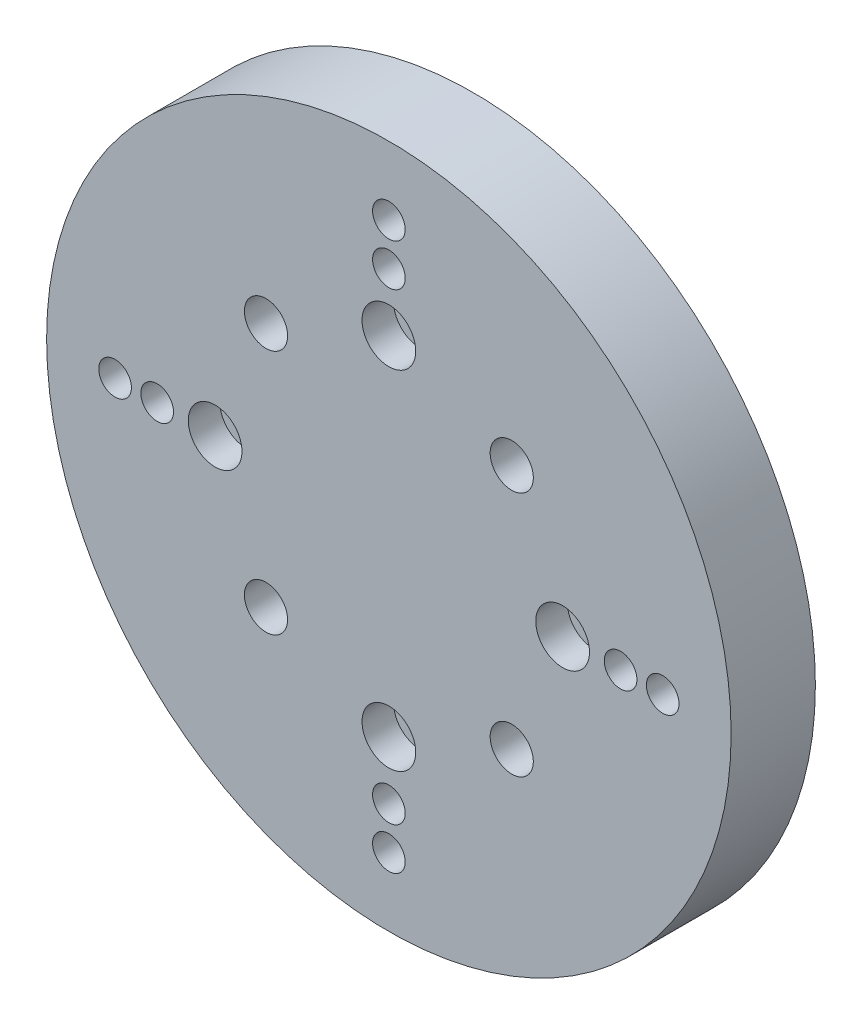
from build123d import *

# Parameters (mm, degrees)
SKETCH1_R           = 55
BOSS_EXTRUDE1_DEPTH = 26
SKETCH2_R           = 1.5
CUT_EXTRUDE1_DEPTH  = 3
SKETCH3_R           = 32.5
BOSS_EXTRUDE2_DEPTH = 8
SKETCH4_R           = 2.55
SKETCH4_R_2         = 1.55
SKETCH4_R_3         = 2.05
CUT_EXTRUDE2_DEPTH  = 3
FILLET1_R           = 2
SKETCH9_R           = 75
CUT_EXTRUDE5_DEPTH  = 83.012194282
SKETCH11_R          = 10
CUT_EXTRUDE6_DEPTH  = 5


with BuildPart() as part:
    # Sketch1 → Boss-Extrude1 (new body)
    with BuildSketch(Plane.XY):
        with Locations(Location((0, 0, 0), (0, 0, 180))):
            Circle(SKETCH1_R)
    extrude(amount=BOSS_EXTRUDE1_DEPTH)

    # Sketch2 → Cut-Extrude1 (cut)
    with BuildSketch(Plane(origin=(0, 0, 0), x_dir=(-1, 0, 0), z_dir=(0, 0, -1))):
        with Locations((0, -21)):
            Circle(SKETCH2_R)
        with Locations((-14.849242405, -14.849242405)):
            Circle(SKETCH2_R)
        with Locations((-21, 0)):
            Circle(SKETCH2_R)
        with Locations((-14.849242405, 14.849242405)):
            Circle(SKETCH2_R)
        with Locations((0, 21)):
            Circle(SKETCH2_R)
        with Locations((14.849242405, 14.849242405)):
            Circle(SKETCH2_R)
        with Locations((21, 0)):
            Circle(SKETCH2_R)
        with Locations((14.849242405, -14.849242405)):
            Circle(SKETCH2_R)
    extrude(amount=-CUT_EXTRUDE1_DEPTH, mode=Mode.SUBTRACT)

    # Sketch3 → Boss-Extrude2 (add)
    with BuildSketch(Plane.XY.offset(26)):
        Circle(SKETCH3_R)
    extrude(amount=BOSS_EXTRUDE2_DEPTH)

    # Sketch4 → Cut-Extrude2 (cut)
    with BuildSketch(Plane.XY.offset(34)):
        with Locations((-16.5, 0)):
            Circle(SKETCH4_R)
        with Locations((0, -16.5)):
            Circle(SKETCH4_R)
        with Locations((16.5, 0)):
            Circle(SKETCH4_R)
        with Locations((0, 16.5)):
            Circle(SKETCH4_R)
        with Locations((0, 26)):
            Circle(SKETCH4_R_2)
        with Locations((0, 22)):
            Circle(SKETCH4_R_2)
        with Locations((-11.66726189, -11.66726189)):
            Circle(SKETCH4_R_3)
        with Locations((11.66726189, -11.66726189)):
            Circle(SKETCH4_R_3)
        with Locations((11.66726189, 11.66726189)):
            Circle(SKETCH4_R_3)
        with Locations((-11.66726189, 11.66726189)):
            Circle(SKETCH4_R_3)
        with Locations((-22, 0)):
            Circle(SKETCH4_R_2)
        with Locations((-26, 0)):
            Circle(SKETCH4_R_2)
        with Locations((0, -22)):
            Circle(SKETCH4_R_2)
        with Locations((0, -26)):
            Circle(SKETCH4_R_2)
        with Locations((22, 0)):
            Circle(SKETCH4_R_2)
        with Locations((26, 0)):
            Circle(SKETCH4_R_2)
    extrude(amount=-CUT_EXTRUDE2_DEPTH, mode=Mode.SUBTRACT)

    # Fillet1
    fillet1_edges = [part.edges().sort_by_distance(p)[0] for p in [
        (55, 0, 0),
        (55, 0, 26),
    ]]
    fillet(fillet1_edges, radius=FILLET1_R)

    # Sketch9 → Cut-Extrude5 (cut, through all)
    with BuildSketch(Plane.XY.offset(26)):
        Circle(SKETCH9_R)
    extrude(amount=-CUT_EXTRUDE5_DEPTH, mode=Mode.SUBTRACT)

    # Sketch11 → Cut-Extrude6 (cut)
    with BuildSketch(Plane(origin=(0, 0, 26), x_dir=(-1, 0, 0), z_dir=(0, 0, -1))):
        Circle(SKETCH11_R)
    extrude(amount=-CUT_EXTRUDE6_DEPTH, mode=Mode.SUBTRACT)


solid = part.part
